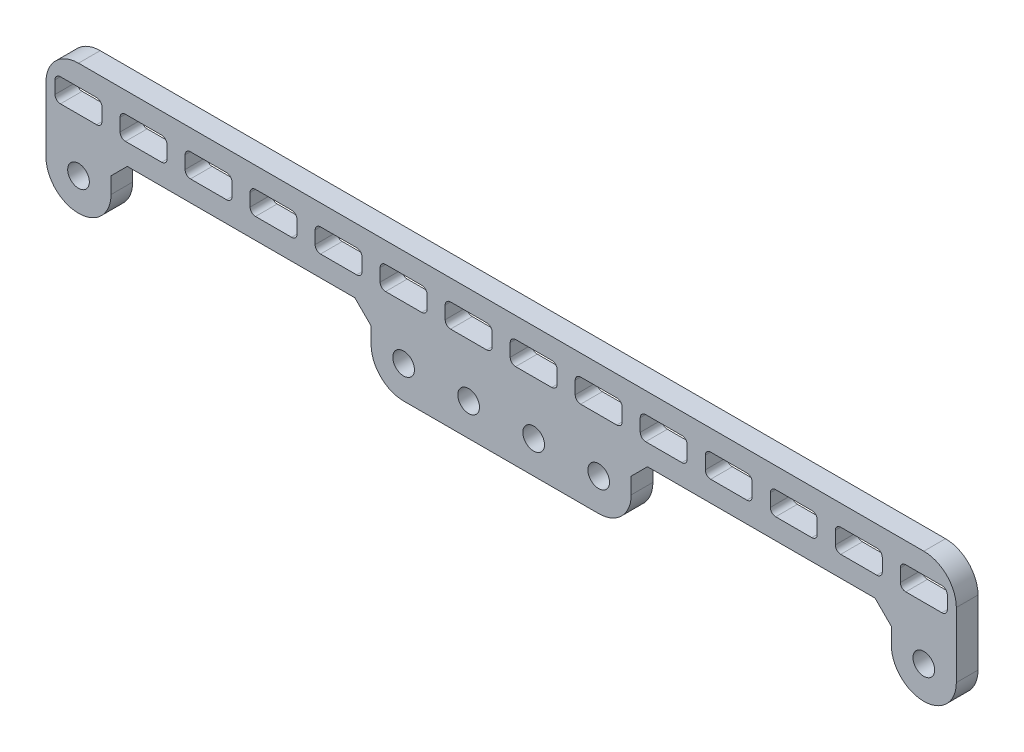
from build123d import *

# Parameters (mm, degrees)
MODEL_R                 = 1.5
SALIENTE_EXTRUIR1_DEPTH = 3


with BuildPart() as part:
    # Model → Saliente-Extruir1 (new body)
    with BuildSketch(Plane.XY):
        with BuildLine():
            Line((238.429131311, 228.742243614), (355.429131311, 228.742243614))
            ThreePointArc((355.429131311, 228.742243614), (358.611111826, 227.424224129), (359.929131311, 224.242243614))
            Line((359.929131311, 224.242243614), (359.929131311, 215.242243614))
            ThreePointArc((359.929131311, 215.242243614), (355.429131311, 210.742243614), (350.929131311, 215.242243614))
            Line((350.929131311, 215.242243614), (350.929131311, 217.492243614))
            Line((350.929131311, 217.492243614), (348.679131311, 219.742243614))
            Line((348.679131311, 219.742243614), (317.179131311, 219.742243614))
            Line((317.179131311, 219.742243614), (314.929131311, 217.492243614))
            Line((314.929131311, 217.492243614), (314.929131311, 215.242243614))
            ThreePointArc((314.929131311, 215.242243614), (313.611111826, 212.060263099), (310.429131311, 210.742243614))
            Line((310.429131311, 210.742243614), (283.429131311, 210.742243614))
            ThreePointArc((283.429131311, 210.742243614), (280.247150795, 212.060263099), (278.929131311, 215.242243614))
            Line((278.929131311, 215.242243614), (278.929131311, 217.492243614))
            Line((278.929131311, 217.492243614), (276.679131311, 219.742243614))
            Line((276.679131311, 219.742243614), (245.179131311, 219.742243614))
            Line((245.179131311, 219.742243614), (242.929131311, 217.492243614))
            Line((242.929131311, 217.492243614), (242.929131311, 215.242243614))
            ThreePointArc((242.929131311, 215.242243614), (238.429131311, 210.742243614), (233.929131311, 215.242243614))
            Line((233.929131311, 215.242243614), (233.929131311, 224.242243614))
            ThreePointArc((233.929131311, 224.242243614), (235.247150795, 227.424224129), (238.429131311, 228.742243614))
        make_face()
        with Locations((283.429131311, 215.242243614)):
            Circle(MODEL_R, mode=Mode.SUBTRACT)
        with Locations((355.429131311, 215.242243614)):
            Circle(MODEL_R, mode=Mode.SUBTRACT)
        with Locations((238.429131311, 215.242243614)):
            Circle(MODEL_R, mode=Mode.SUBTRACT)
        with Locations((310.429131311, 215.242243614)):
            Circle(MODEL_R, mode=Mode.SUBTRACT)
        with Locations((292.429131311, 215.242243614)):
            Circle(MODEL_R, mode=Mode.SUBTRACT)
        with Locations((301.429131311, 215.242243614)):
            Circle(MODEL_R, mode=Mode.SUBTRACT)
        with BuildLine():
            Line((321.929131311, 222.617243614), (316.929131311, 222.617243614))
            ThreePointArc((316.929131311, 222.617243614), (316.398801225, 222.836913528), (316.179131311, 223.367243614))
            Line((316.179131311, 223.367243614), (316.179131311, 225.117243614))
            ThreePointArc((316.179131311, 225.117243614), (316.398801225, 225.6475737), (316.929131311, 225.867243614))
            Line((316.929131311, 225.867243614), (321.929131311, 225.867243614))
            ThreePointArc((321.929131311, 225.867243614), (322.459461397, 225.6475737), (322.679131311, 225.117243614))
            Line((322.679131311, 225.117243614), (322.679131311, 223.367243614))
            ThreePointArc((322.679131311, 223.367243614), (322.459461397, 222.836913528), (321.929131311, 222.617243614))
        make_face(mode=Mode.SUBTRACT)
        with BuildLine():
            Line((357.929131311, 222.617243614), (352.929131311, 222.617243614))
            ThreePointArc((352.929131311, 222.617243614), (352.398801225, 222.836913528), (352.179131311, 223.367243614))
            Line((352.179131311, 223.367243614), (352.179131311, 225.117243614))
            ThreePointArc((352.179131311, 225.117243614), (352.398801225, 225.6475737), (352.929131311, 225.867243614))
            Line((352.929131311, 225.867243614), (357.929131311, 225.867243614))
            ThreePointArc((357.929131311, 225.867243614), (358.459461397, 225.6475737), (358.679131311, 225.117243614))
            Line((358.679131311, 225.117243614), (358.679131311, 223.367243614))
            ThreePointArc((358.679131311, 223.367243614), (358.459461397, 222.836913528), (357.929131311, 222.617243614))
        make_face(mode=Mode.SUBTRACT)
        with BuildLine():
            Line((348.929131311, 222.617243614), (343.929131311, 222.617243614))
            ThreePointArc((343.929131311, 222.617243614), (343.398801225, 222.836913528), (343.179131311, 223.367243614))
            Line((343.179131311, 223.367243614), (343.179131311, 225.117243614))
            ThreePointArc((343.179131311, 225.117243614), (343.398801225, 225.6475737), (343.929131311, 225.867243614))
            Line((343.929131311, 225.867243614), (348.929131311, 225.867243614))
            ThreePointArc((348.929131311, 225.867243614), (349.459461397, 225.6475737), (349.679131311, 225.117243614))
            Line((349.679131311, 225.117243614), (349.679131311, 223.367243614))
            ThreePointArc((349.679131311, 223.367243614), (349.459461397, 222.836913528), (348.929131311, 222.617243614))
        make_face(mode=Mode.SUBTRACT)
        with BuildLine():
            Line((339.929131311, 222.617243614), (334.929131311, 222.617243614))
            ThreePointArc((334.929131311, 222.617243614), (334.398801225, 222.836913528), (334.179131311, 223.367243614))
            Line((334.179131311, 223.367243614), (334.179131311, 225.117243614))
            ThreePointArc((334.179131311, 225.117243614), (334.398801225, 225.6475737), (334.929131311, 225.867243614))
            Line((334.929131311, 225.867243614), (339.929131311, 225.867243614))
            ThreePointArc((339.929131311, 225.867243614), (340.459461397, 225.6475737), (340.679131311, 225.117243614))
            Line((340.679131311, 225.117243614), (340.679131311, 223.367243614))
            ThreePointArc((340.679131311, 223.367243614), (340.459461397, 222.836913528), (339.929131311, 222.617243614))
        make_face(mode=Mode.SUBTRACT)
        with BuildLine():
            Line((330.929131311, 222.617243614), (325.929131311, 222.617243614))
            ThreePointArc((325.929131311, 222.617243614), (325.398801225, 222.836913528), (325.179131311, 223.367243614))
            Line((325.179131311, 223.367243614), (325.179131311, 225.117243614))
            ThreePointArc((325.179131311, 225.117243614), (325.398801225, 225.6475737), (325.929131311, 225.867243614))
            Line((325.929131311, 225.867243614), (330.929131311, 225.867243614))
            ThreePointArc((330.929131311, 225.867243614), (331.459461397, 225.6475737), (331.679131311, 225.117243614))
            Line((331.679131311, 225.117243614), (331.679131311, 223.367243614))
            ThreePointArc((331.679131311, 223.367243614), (331.459461397, 222.836913528), (330.929131311, 222.617243614))
        make_face(mode=Mode.SUBTRACT)
        with BuildLine():
            Line((271.929131311, 222.617243614), (276.929131311, 222.617243614))
            ThreePointArc((276.929131311, 222.617243614), (277.459461397, 222.836913528), (277.679131311, 223.367243614))
            Line((277.679131311, 223.367243614), (277.679131311, 225.117243614))
            ThreePointArc((277.679131311, 225.117243614), (277.459461397, 225.6475737), (276.929131311, 225.867243614))
            Line((276.929131311, 225.867243614), (271.929131311, 225.867243614))
            ThreePointArc((271.929131311, 225.867243614), (271.398801225, 225.6475737), (271.179131311, 225.117243614))
            Line((271.179131311, 225.117243614), (271.179131311, 223.367243614))
            ThreePointArc((271.179131311, 223.367243614), (271.398801225, 222.836913528), (271.929131311, 222.617243614))
        make_face(mode=Mode.SUBTRACT)
        with BuildLine():
            Line((235.929131311, 222.617243614), (240.929131311, 222.617243614))
            ThreePointArc((240.929131311, 222.617243614), (241.459461397, 222.836913528), (241.679131311, 223.367243614))
            Line((241.679131311, 223.367243614), (241.679131311, 225.117243614))
            ThreePointArc((241.679131311, 225.117243614), (241.459461397, 225.6475737), (240.929131311, 225.867243614))
            Line((240.929131311, 225.867243614), (235.929131311, 225.867243614))
            ThreePointArc((235.929131311, 225.867243614), (235.398801225, 225.6475737), (235.179131311, 225.117243614))
            Line((235.179131311, 225.117243614), (235.179131311, 223.367243614))
            ThreePointArc((235.179131311, 223.367243614), (235.398801225, 222.836913528), (235.929131311, 222.617243614))
        make_face(mode=Mode.SUBTRACT)
        with BuildLine():
            Line((244.929131311, 222.617243614), (249.929131311, 222.617243614))
            ThreePointArc((249.929131311, 222.617243614), (250.459461397, 222.836913528), (250.679131311, 223.367243614))
            Line((250.679131311, 223.367243614), (250.679131311, 225.117243614))
            ThreePointArc((250.679131311, 225.117243614), (250.459461397, 225.6475737), (249.929131311, 225.867243614))
            Line((249.929131311, 225.867243614), (244.929131311, 225.867243614))
            ThreePointArc((244.929131311, 225.867243614), (244.398801225, 225.6475737), (244.179131311, 225.117243614))
            Line((244.179131311, 225.117243614), (244.179131311, 223.367243614))
            ThreePointArc((244.179131311, 223.367243614), (244.398801225, 222.836913528), (244.929131311, 222.617243614))
        make_face(mode=Mode.SUBTRACT)
        with BuildLine():
            Line((253.929131311, 222.617243614), (258.929131311, 222.617243614))
            ThreePointArc((258.929131311, 222.617243614), (259.459461397, 222.836913528), (259.679131311, 223.367243614))
            Line((259.679131311, 223.367243614), (259.679131311, 225.117243614))
            ThreePointArc((259.679131311, 225.117243614), (259.459461397, 225.6475737), (258.929131311, 225.867243614))
            Line((258.929131311, 225.867243614), (253.929131311, 225.867243614))
            ThreePointArc((253.929131311, 225.867243614), (253.398801225, 225.6475737), (253.179131311, 225.117243614))
            Line((253.179131311, 225.117243614), (253.179131311, 223.367243614))
            ThreePointArc((253.179131311, 223.367243614), (253.398801225, 222.836913528), (253.929131311, 222.617243614))
        make_face(mode=Mode.SUBTRACT)
        with BuildLine():
            Line((262.929131311, 222.617243614), (267.929131311, 222.617243614))
            ThreePointArc((267.929131311, 222.617243614), (268.459461397, 222.836913528), (268.679131311, 223.367243614))
            Line((268.679131311, 223.367243614), (268.679131311, 225.117243614))
            ThreePointArc((268.679131311, 225.117243614), (268.459461397, 225.6475737), (267.929131311, 225.867243614))
            Line((267.929131311, 225.867243614), (262.929131311, 225.867243614))
            ThreePointArc((262.929131311, 225.867243614), (262.398801225, 225.6475737), (262.179131311, 225.117243614))
            Line((262.179131311, 225.117243614), (262.179131311, 223.367243614))
            ThreePointArc((262.179131311, 223.367243614), (262.398801225, 222.836913528), (262.929131311, 222.617243614))
        make_face(mode=Mode.SUBTRACT)
        with BuildLine():
            Line((307.929131311, 222.617243614), (312.929131311, 222.617243614))
            ThreePointArc((312.929131311, 222.617243614), (313.459461397, 222.836913528), (313.679131311, 223.367243614))
            Line((313.679131311, 223.367243614), (313.679131311, 225.117243614))
            ThreePointArc((313.679131311, 225.117243614), (313.459461397, 225.6475737), (312.929131311, 225.867243614))
            Line((312.929131311, 225.867243614), (307.929131311, 225.867243614))
            ThreePointArc((307.929131311, 225.867243614), (307.398801225, 225.6475737), (307.179131311, 225.117243614))
            Line((307.179131311, 225.117243614), (307.179131311, 223.367243614))
            ThreePointArc((307.179131311, 223.367243614), (307.398801225, 222.836913528), (307.929131311, 222.617243614))
        make_face(mode=Mode.SUBTRACT)
        with BuildLine():
            Line((280.929131311, 222.617243614), (285.929131311, 222.617243614))
            ThreePointArc((285.929131311, 222.617243614), (286.459461397, 222.836913528), (286.679131311, 223.367243614))
            Line((286.679131311, 223.367243614), (286.679131311, 225.117243614))
            ThreePointArc((286.679131311, 225.117243614), (286.459461397, 225.6475737), (285.929131311, 225.867243614))
            Line((285.929131311, 225.867243614), (280.929131311, 225.867243614))
            ThreePointArc((280.929131311, 225.867243614), (280.398801225, 225.6475737), (280.179131311, 225.117243614))
            Line((280.179131311, 225.117243614), (280.179131311, 223.367243614))
            ThreePointArc((280.179131311, 223.367243614), (280.398801225, 222.836913528), (280.929131311, 222.617243614))
        make_face(mode=Mode.SUBTRACT)
        with BuildLine():
            Line((289.929131311, 222.617243614), (294.929131311, 222.617243614))
            ThreePointArc((294.929131311, 222.617243614), (295.459461397, 222.836913528), (295.679131311, 223.367243614))
            Line((295.679131311, 223.367243614), (295.679131311, 225.117243614))
            ThreePointArc((295.679131311, 225.117243614), (295.459461397, 225.6475737), (294.929131311, 225.867243614))
            Line((294.929131311, 225.867243614), (289.929131311, 225.867243614))
            ThreePointArc((289.929131311, 225.867243614), (289.398801225, 225.6475737), (289.179131311, 225.117243614))
            Line((289.179131311, 225.117243614), (289.179131311, 223.367243614))
            ThreePointArc((289.179131311, 223.367243614), (289.398801225, 222.836913528), (289.929131311, 222.617243614))
        make_face(mode=Mode.SUBTRACT)
        with BuildLine():
            Line((298.929131311, 222.617243614), (303.929131311, 222.617243614))
            ThreePointArc((303.929131311, 222.617243614), (304.459461397, 222.836913528), (304.679131311, 223.367243614))
            Line((304.679131311, 223.367243614), (304.679131311, 225.117243614))
            ThreePointArc((304.679131311, 225.117243614), (304.459461397, 225.6475737), (303.929131311, 225.867243614))
            Line((303.929131311, 225.867243614), (298.929131311, 225.867243614))
            ThreePointArc((298.929131311, 225.867243614), (298.398801225, 225.6475737), (298.179131311, 225.117243614))
            Line((298.179131311, 225.117243614), (298.179131311, 223.367243614))
            ThreePointArc((298.179131311, 223.367243614), (298.398801225, 222.836913528), (298.929131311, 222.617243614))
        make_face(mode=Mode.SUBTRACT)
    extrude(amount=SALIENTE_EXTRUIR1_DEPTH)


solid = part.part
